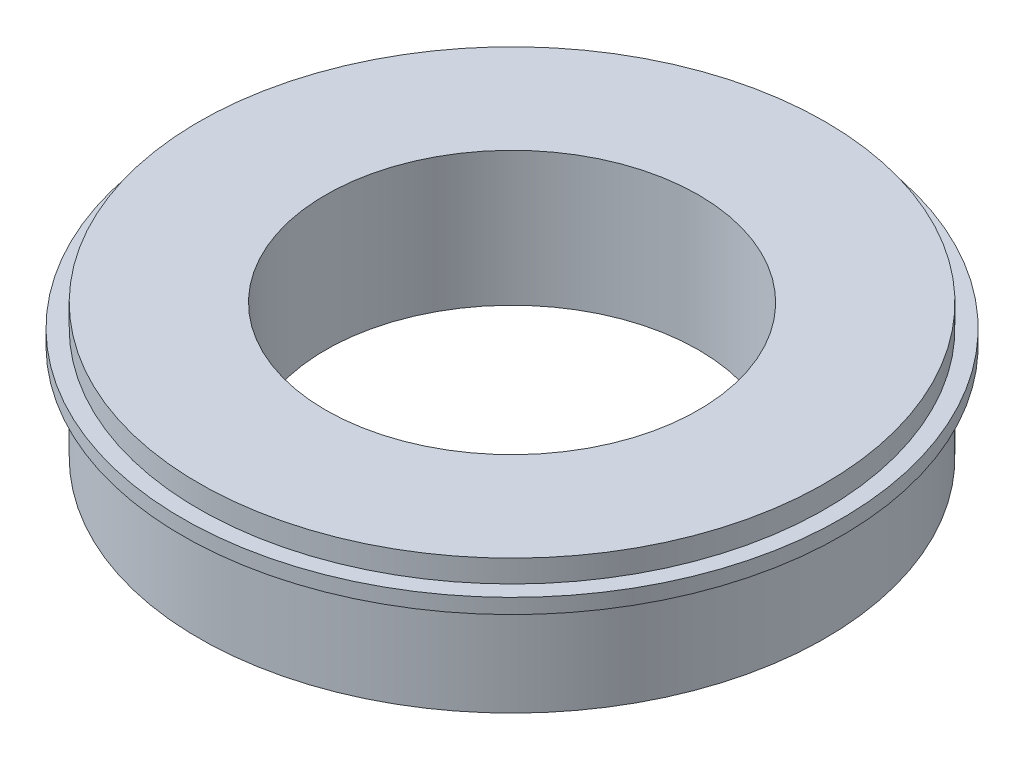
from build123d import *


with BuildPart() as part:
    # Croquis1 → Revolución1 (revolve)
    with BuildSketch(Plane.XY, mode=Mode.PRIVATE) as revoluci_n1_sk:
        Polygon((21, 7.5), (21, 9), (12.5, 9), (12.5, 0), (21, 0), (21, 6.5), (22.1, 6.5), (22.1, 7.5), align=None)
    revolve(revoluci_n1_sk.sketch.rotate(Axis((0, 0, 0), (0, 1, 0)), 90), axis=Axis((0, 0, 0), (0, 1, 0)))


solid = part.part
